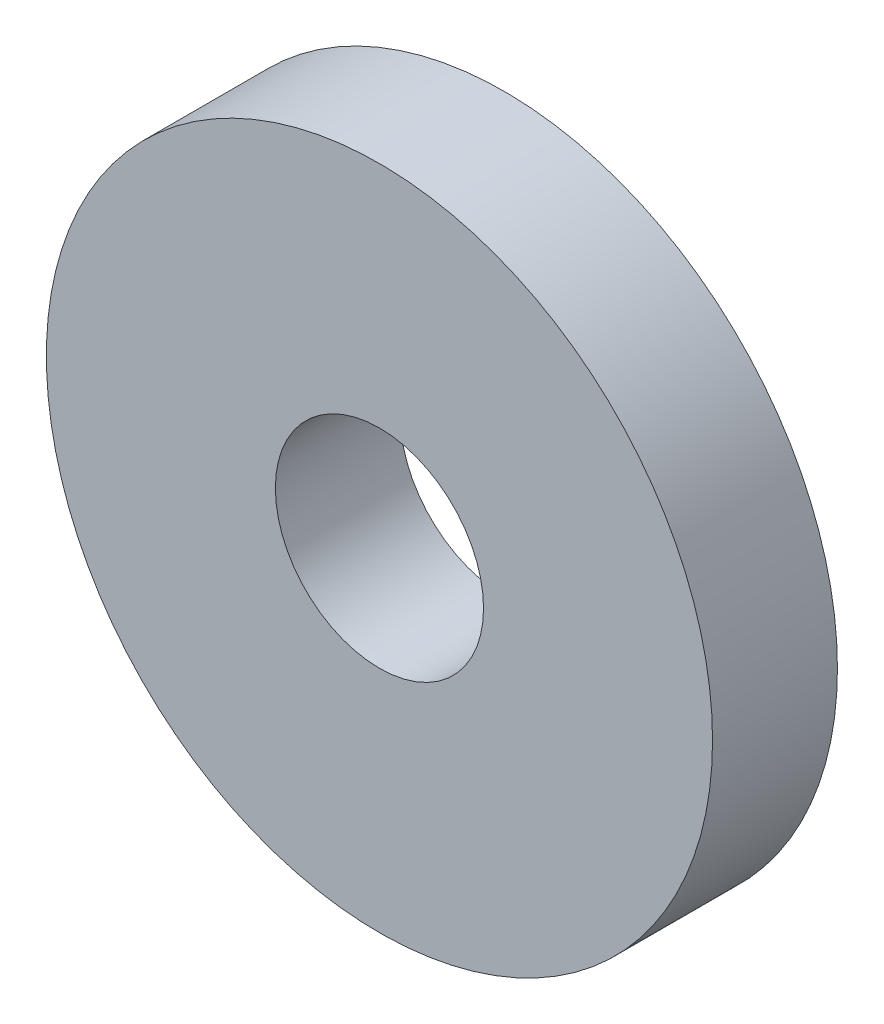
from build123d import *

# Parameters (mm, degrees)
SKETCH1_R           = 8
BOSS_EXTRUDE1_DEPTH = 3
SKETCH2_R           = 2.5
CUT_EXTRUDE1_DEPTH  = 3


with BuildPart() as part:
    # Sketch1 → Boss-Extrude1 (new body)
    with BuildSketch(Plane.XY):
        Circle(SKETCH1_R)
    extrude(amount=BOSS_EXTRUDE1_DEPTH)

    # Sketch2 → Cut-Extrude1 (cut)
    with BuildSketch(Plane.XY.offset(3)):
        Circle(SKETCH2_R)
    extrude(amount=-CUT_EXTRUDE1_DEPTH, mode=Mode.SUBTRACT)


solid = part.part
